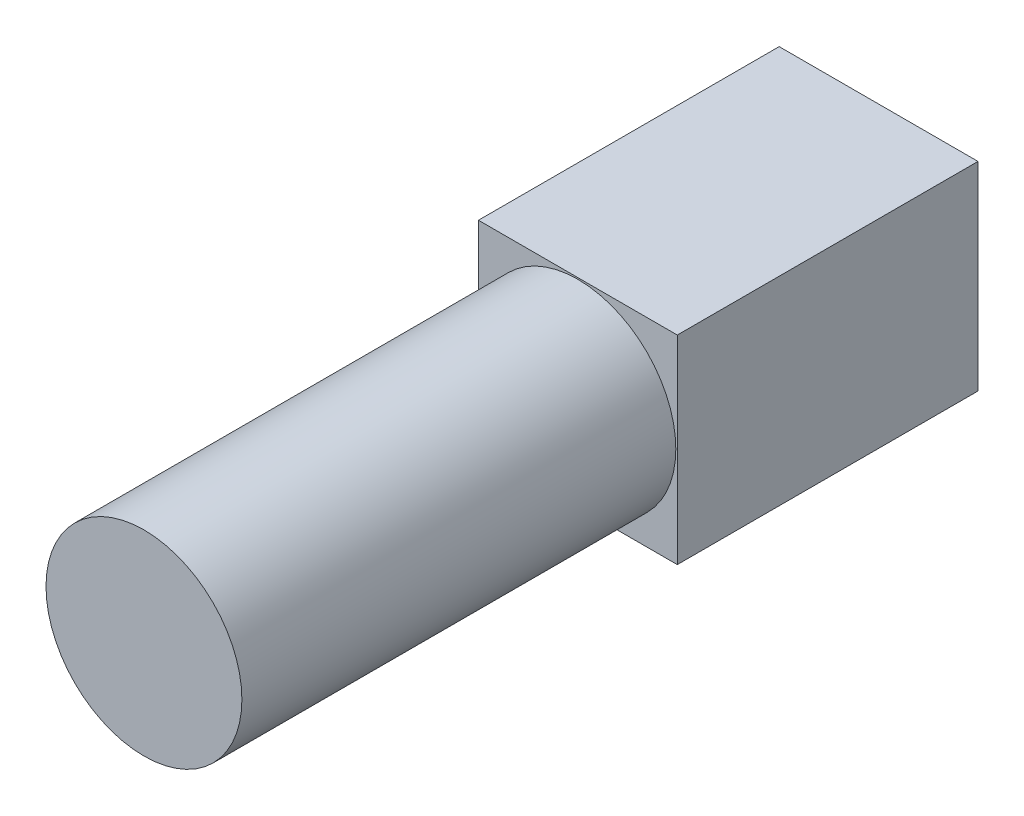
from build123d import *

# Parameters (mm, degrees)
SKETCH1_W           = 8.12
SKETCH1_H           = 8.12
BOSS_EXTRUDE1_DEPTH = 12.28
SKETCH2_R           = 4
BOSS_EXTRUDE2_DEPTH = 30


with BuildPart() as part:
    # Sketch1 → Boss-Extrude1 (new body)
    with BuildSketch(Plane.XY):
        Rectangle(SKETCH1_W, SKETCH1_H)
    extrude(amount=BOSS_EXTRUDE1_DEPTH)

    # Sketch2 → Boss-Extrude2 (add)
    with BuildSketch(Plane.XY):
        with Locations(Location((0, 0, 0), (0, 0, 180))):
            Circle(SKETCH2_R)
    extrude(amount=BOSS_EXTRUDE2_DEPTH)


solid = part.part
